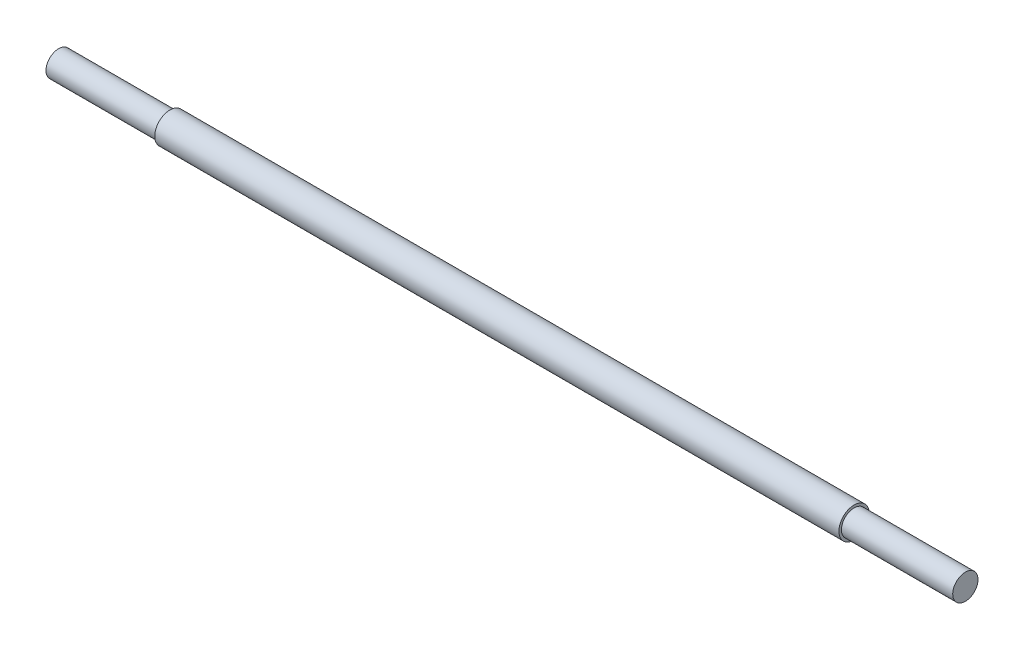
from build123d import *


with BuildPart() as part:
    # Sketch1 → Revolve1 (revolve)
    with BuildSketch(Plane.XY, mode=Mode.PRIVATE) as revolve1_sk:
        Polygon((0, 0), (89.63, 0), (89.63, 1.25), (78.63, 1.25), (78.63, 1.5), (11, 1.5), (11, 1.25), (0, 1.25), align=None)
    revolve(revolve1_sk.sketch.rotate(Axis((0, 0, 0), (1, 0, 0)), 180), axis=Axis((0, 0, 0), (1, 0, 0)))


solid = part.part
